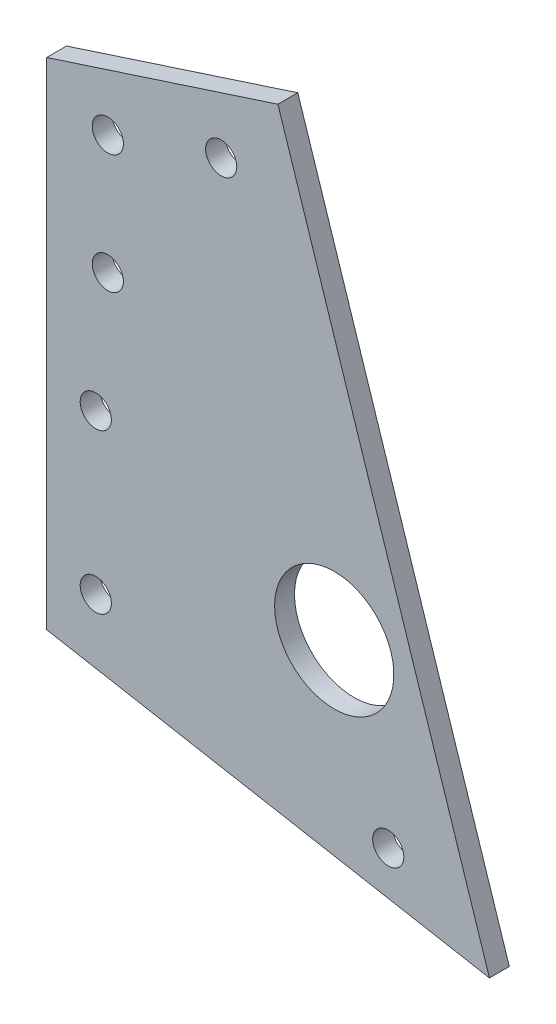
from build123d import *

# Parameters (mm, degrees)
BOSS_EXTRUDE1_DEPTH    = 3.175
F_10_CLEARANCE_HOLE1_D = 4.9784
SKETCH8_R              = 9.525
CUT_EXTRUDE1_DEPTH     = 305.646421585


with BuildPart() as part:
    # Sketch2 → Boss-Extrude1 (new body)
    with BuildSketch(Plane.XY):
        Polygon((75.605515224, 191.084223429), (41.804664545, 295.09857273), (4.854209552, 283.091029346), (4.854209552, 203.901454104), align=None)
    extrude(amount=BOSS_EXTRUDE1_DEPTH)

    # #10 Clearance Hole1 (through all)
    with Locations(Plane.XY.offset(3.175)):
        with Locations((32.740251946, 283.138719963), (59.435154755, 200.980257064), (12.7, 238.125), (12.7, 212.725), (14.622625311, 277.25194622), (14.622625311, 258.20194622)):
            Hole(F_10_CLEARANCE_HOLE1_D / 2)

    # Sketch8 → Cut-Extrude1 (cut, through all)
    with BuildSketch(Plane(origin=(0, 0, 0), x_dir=(-1, 0, 0), z_dir=(0, 0, -1))):
        with Locations((-50.8, 225.425)):
            Circle(SKETCH8_R)
    extrude(amount=-CUT_EXTRUDE1_DEPTH, mode=Mode.SUBTRACT)


solid = part.part
